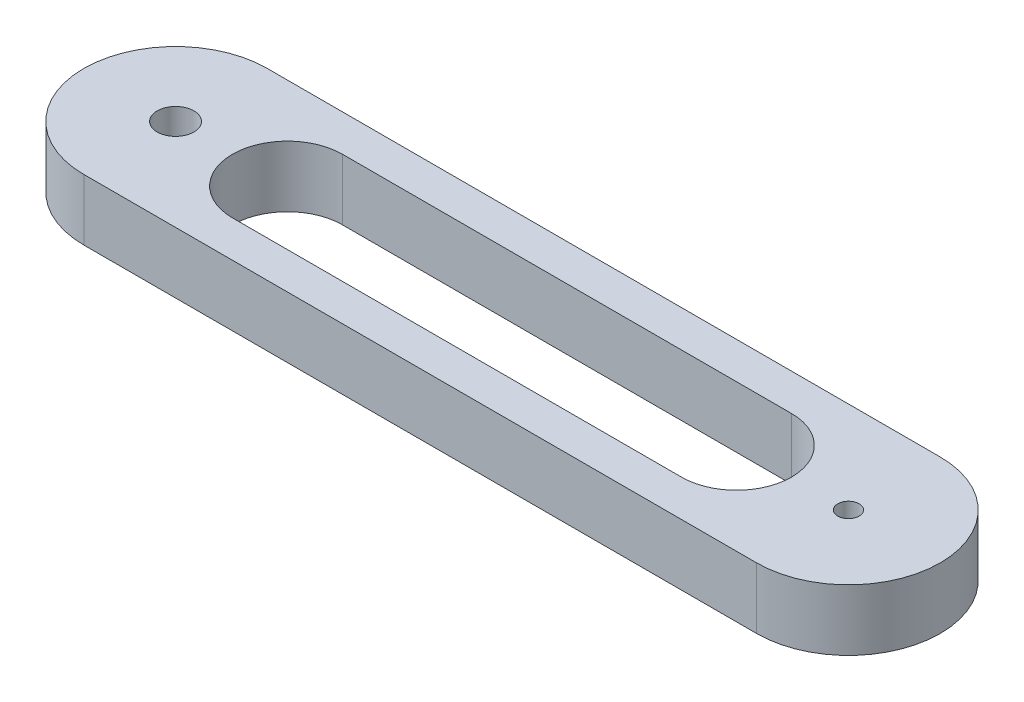
from build123d import *

# Parameters (mm, degrees)
SKETCH2_R           = 1.45
SKETCH2_R_2         = 1.5
BOSS_EXTRUDE1_DEPTH = 10
SKETCH3_R           = 2.925
CUT_EXTRUDE1_DEPTH  = 2
CUT_EXTRUDE2_DEPTH  = 10
SKETCH5_R           = 3
CUT_EXTRUDE3_DEPTH  = 10
SKETCH6_R           = 1.75
CUT_EXTRUDE4_DEPTH  = 10


with BuildPart() as part:
    # Sketch2 → Boss-Extrude1 (new body)
    with BuildSketch(Plane(origin=(0, 0, 0), x_dir=(1, 0, 0), z_dir=(0, 1, 0))):
        with BuildLine():
            Line((0, 15), (110, 15))
            ThreePointArc((110, 15), (125, 0), (110, -15))
            Line((110, -15), (0, -15))
            ThreePointArc((0, -15), (-15, 0), (0, 15))
        make_face()
        with Locations(Location((0, 0, 0), (0, 0, 270))):
            Circle(SKETCH2_R, mode=Mode.SUBTRACT)
        with Locations(Location((110, 0, 0), (0, 0, 270))):
            Circle(SKETCH2_R_2, mode=Mode.SUBTRACT)
    extrude(amount=BOSS_EXTRUDE1_DEPTH)

    # Sketch3 → Cut-Extrude1 (cut)
    with BuildSketch(Plane(origin=(0, 10, 0), x_dir=(1, 0, 0), z_dir=(0, 1, 0))):
        with Locations(Location((0, 0, 0), (0, 0, 270))):
            Circle(SKETCH3_R)
    extrude(amount=-CUT_EXTRUDE1_DEPTH, mode=Mode.SUBTRACT)

    # Sketch4 → Cut-Extrude2 (cut)
    with BuildSketch(Plane(origin=(0, 10, 0), x_dir=(1, 0, 0), z_dir=(0, 1, 0))):
        with BuildLine():
            Line((18.295710574, 9), (91.7, 9))
            ThreePointArc((91.7, 9), (100.7, 0), (91.7, -9))
            Line((91.7, -9), (18.295710574, -9))
            ThreePointArc((18.295710574, -9), (9.295710574, 0), (18.295710574, 9))
        make_face()
    extrude(amount=-CUT_EXTRUDE2_DEPTH, mode=Mode.SUBTRACT)

    # Sketch5 → Cut-Extrude3 (cut)
    with BuildSketch(Plane(origin=(0, 10, 0), x_dir=(1, 0, 0), z_dir=(0, 1, 0))):
        with Locations(Location((0, 0, 0), (0, 0, 270))):
            Circle(SKETCH5_R)
    extrude(amount=-CUT_EXTRUDE3_DEPTH, mode=Mode.SUBTRACT)

    # Sketch6 → Cut-Extrude4 (cut)
    with BuildSketch(Plane(origin=(0, 10, 0), x_dir=(1, 0, 0), z_dir=(0, 1, 0))):
        with Locations(Location((110, 0, 0), (0, 0, 270))):
            Circle(SKETCH6_R)
    extrude(amount=-CUT_EXTRUDE4_DEPTH, mode=Mode.SUBTRACT)


solid = part.part
